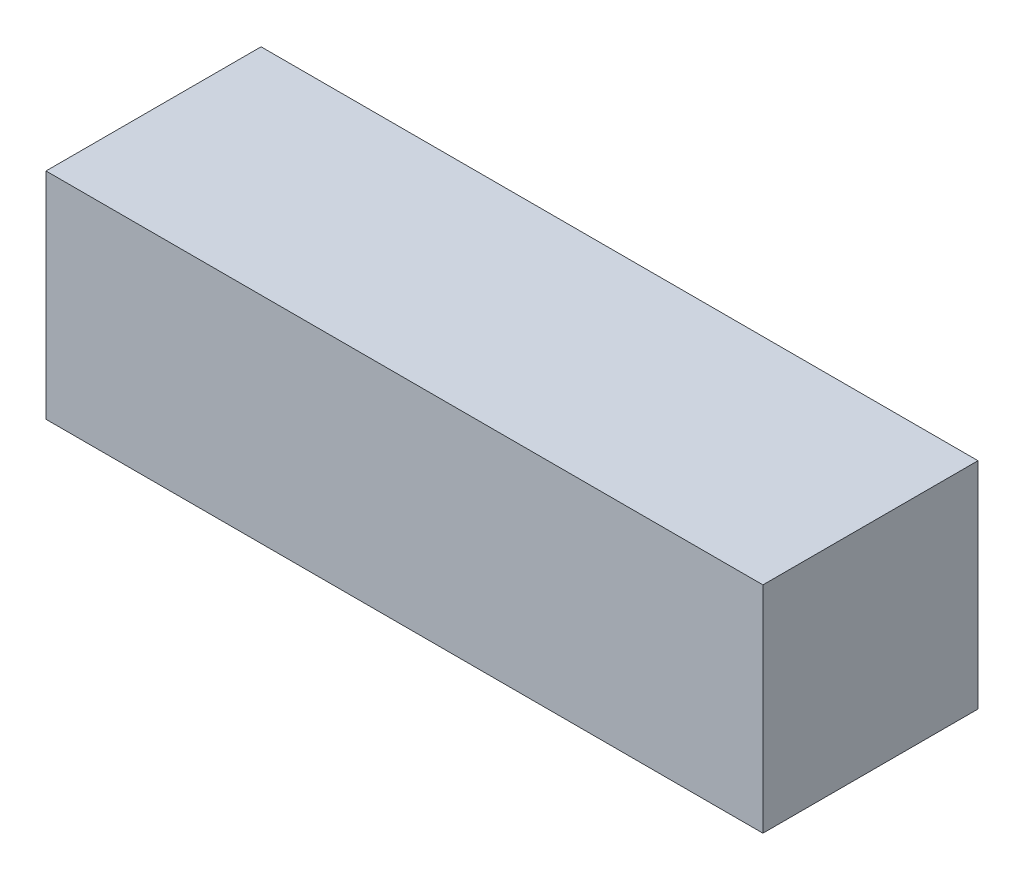
from build123d import *

# Parameters (mm, degrees)
SKETCH1_W           = 38.1
SKETCH1_H           = 38.1
BOSS_EXTRUDE1_DEPTH = 127


with BuildPart() as part:
    # Sketch1 → Boss-Extrude1 (new body)
    with BuildSketch(Plane(origin=(0, 0, 0), x_dir=(0, 0, -1), z_dir=(1, 0, 0))):
        Rectangle(SKETCH1_W, SKETCH1_H)
    extrude(amount=BOSS_EXTRUDE1_DEPTH)


solid = part.part
